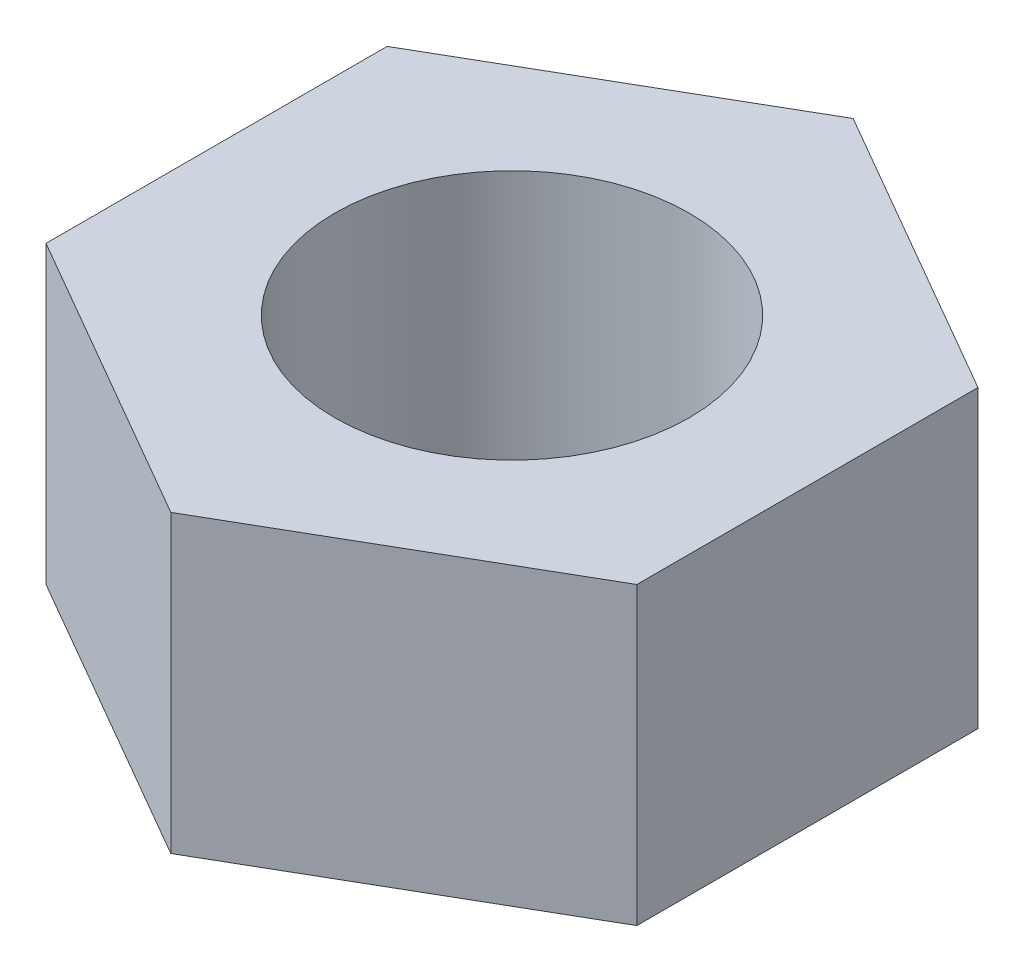
from build123d import *

# Parameters (mm, degrees)
BOSS_EXTRUDE1_DEPTH = 2.5
SKETCH2_R           = 1.5
CUT_EXTRUDE1_DEPTH  = 2.5


with BuildPart() as part:
    # Sketch1 → Boss-Extrude1 (new body)
    with BuildSketch(Plane(origin=(0, 0, 0), x_dir=(1, 0, 0), z_dir=(0, 1, 0))):
        Polygon((0, 2.886751346), (-2.5, 1.443375673), (-2.5, -1.443375673), (0, -2.886751346), (2.5, -1.443375673), (2.5, 1.443375673), align=None)
    extrude(amount=BOSS_EXTRUDE1_DEPTH)

    # Sketch2 → Cut-Extrude1 (cut)
    with BuildSketch(Plane(origin=(0, 2.5, 0), x_dir=(1, 0, 0), z_dir=(0, 1, 0))):
        with Locations(Location((0, 0, 0), (0, 0, 270))):
            Circle(SKETCH2_R)
    extrude(amount=-CUT_EXTRUDE1_DEPTH, mode=Mode.SUBTRACT)


solid = part.part
